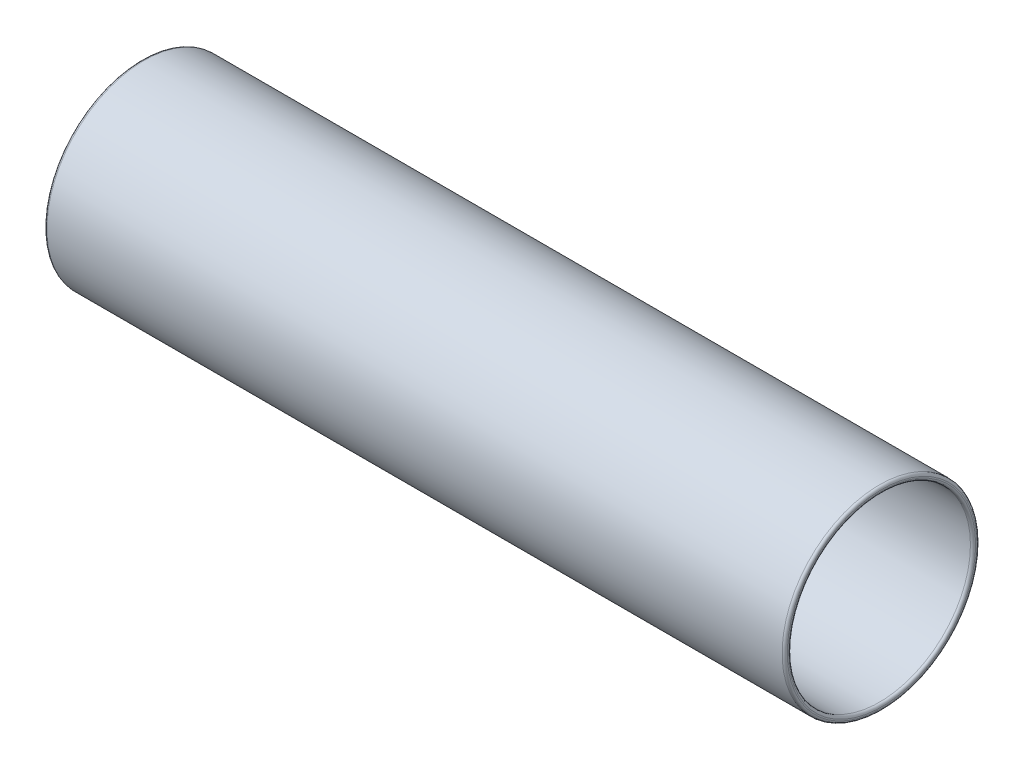
from build123d import *

# Parameters (mm, degrees)
SZKIC1_W        = 570
SZKIC1_H        = 5
ZAOKR_GLENIE1_R = 2


with BuildPart() as part:
    # Szkic1 → Obrót1 (revolve)
    with BuildSketch(Plane.XY, mode=Mode.PRIVATE) as obr_t1_sk:
        with Locations((126.315789474, 72.5)):
            Rectangle(SZKIC1_W, SZKIC1_H)
    revolve(obr_t1_sk.sketch.rotate(Axis((0, 0, 0), (1, 0, 0)), 90), axis=Axis((0, 0, 0), (1, 0, 0)))

    # Zaokrąglenie1
    zaokr_glenie1_edges = [part.edges().sort_by_distance(p)[0] for p in [
        (-158.684210526, 0, -75),
        (411.315789474, 0, -75),
        (411.315789474, 0, -70),
        (-158.684210526, 0, -70),
    ]]
    fillet(zaokr_glenie1_edges, radius=ZAOKR_GLENIE1_R)


solid = part.part
